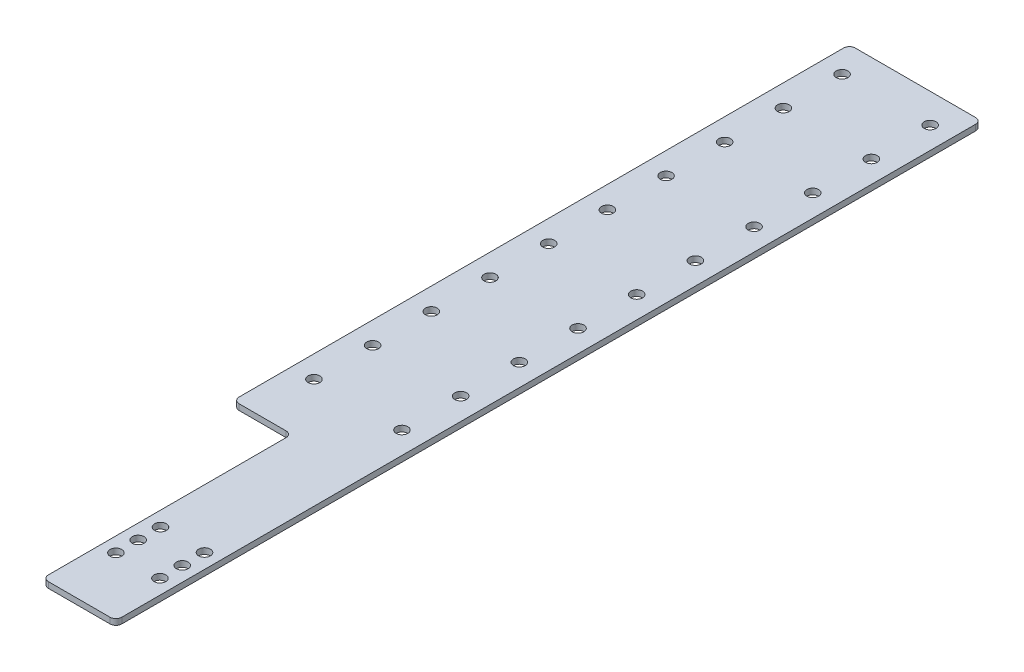
from build123d import *

# Parameters (mm, degrees)
BOSS_EXTRUDE1_DEPTH     = 1.27
CUT_EXTRUDE1_DEPTH      = 373.740805793
CUT_EXTRUDE1_DEPTH_BACK = 373.740805793
SKETCH2_R               = 2.54
CUT_EXTRUDE2_DEPTH      = 373.740805793
CUT_EXTRUDE2_DEPTH_BACK = 373.740805793
SKETCH3_R               = 2.54
FILLET2_R               = 2.54


with BuildPart() as part:
    # Sketch1 → Boss-Extrude1 (new, symmetric)
    with BuildSketch(Plane(origin=(0, 0, 0), x_dir=(1, 0, 0), z_dir=(0, 1, 0))):
        Polygon((-34.188416223, -6.711856618), (-2.438416223, -6.711856618), (-2.438416223, 367.938143382), (-59.588416223, 367.938143382), (-59.588416223, 101.238143382), (-34.188416223, 101.238143382), align=None)
    extrude(amount=BOSS_EXTRUDE1_DEPTH, both=True)

    # Sketch2 → Cut-Extrude1 (cut, two sides: drawn at the far end of the back side and taken through both)
    with BuildSketch(Plane(origin=(0, 1.27, 0), x_dir=(1, 0, 0), z_dir=(0, 1, 0)).offset(-CUT_EXTRUDE1_DEPTH_BACK)):
        with Locations(Location((-27.838416223, 18.688143382, 0), (0, 0, 270))):
            Circle(SKETCH2_R)
        with Locations(Location((-8.788416223, 18.688143382, 0), (0, 0, 270))):
            Circle(SKETCH2_R)
        with Locations(Location((-8.788416223, 28.340143382, 0), (0, 0, 270))):
            Circle(SKETCH2_R)
        with Locations(Location((-8.788416223, 37.992143382, 0), (0, 0, 270))):
            Circle(SKETCH2_R)
        with Locations(Location((-27.838416223, 28.340143382, 0), (0, 0, 270))):
            Circle(SKETCH2_R)
        with Locations(Location((-27.838416223, 37.992143382, 0), (0, 0, 270))):
            Circle(SKETCH2_R)
    extrude(amount=CUT_EXTRUDE1_DEPTH + CUT_EXTRUDE1_DEPTH_BACK, mode=Mode.SUBTRACT)

    # Sketch3 → Cut-Extrude2 (cut, two sides: drawn at the far end of the back side and taken through both)
    with BuildSketch(Plane(origin=(0, 1.27, 0), x_dir=(1, 0, 0), z_dir=(0, 1, 0)).offset(-CUT_EXTRUDE2_DEPTH_BACK)):
        with Locations(Location((-50.063416223, 126.638143382, 0), (0, 0, 270))):
            Circle(SKETCH3_R)
        with Locations(Location((-11.963416223, 126.638143382, 0), (0, 0, 270))):
            Circle(SKETCH3_R)
        with Locations(Location((-11.963416223, 152.038143382, 0), (0, 0, 270))):
            Circle(SKETCH3_R)
        with Locations(Location((-11.963416223, 177.438143382, 0), (0, 0, 270))):
            Circle(SKETCH3_R)
        with Locations(Location((-11.963416223, 202.838143382, 0), (0, 0, 270))):
            Circle(SKETCH3_R)
        with Locations(Location((-11.963416223, 228.238143382, 0), (0, 0, 270))):
            Circle(SKETCH3_R)
        with Locations(Location((-11.963416223, 253.638143382, 0), (0, 0, 270))):
            Circle(SKETCH3_R)
        with Locations(Location((-11.963416223, 279.038143382, 0), (0, 0, 270))):
            Circle(SKETCH3_R)
        with Locations(Location((-11.963416223, 304.438143382, 0), (0, 0, 270))):
            Circle(SKETCH3_R)
        with Locations(Location((-11.963416223, 329.838143382, 0), (0, 0, 270))):
            Circle(SKETCH3_R)
        with Locations(Location((-11.963416223, 355.238143382, 0), (0, 0, 270))):
            Circle(SKETCH3_R)
        with Locations(Location((-50.063416223, 152.038143382, 0), (0, 0, 270))):
            Circle(SKETCH3_R)
        with Locations(Location((-50.063416223, 177.438143382, 0), (0, 0, 270))):
            Circle(SKETCH3_R)
        with Locations(Location((-50.063416223, 202.838143382, 0), (0, 0, 270))):
            Circle(SKETCH3_R)
        with Locations(Location((-50.063416223, 228.238143382, 0), (0, 0, 270))):
            Circle(SKETCH3_R)
        with Locations(Location((-50.063416223, 253.638143382, 0), (0, 0, 270))):
            Circle(SKETCH3_R)
        with Locations(Location((-50.063416223, 279.038143382, 0), (0, 0, 270))):
            Circle(SKETCH3_R)
        with Locations(Location((-50.063416223, 304.438143382, 0), (0, 0, 270))):
            Circle(SKETCH3_R)
        with Locations(Location((-50.063416223, 329.838143382, 0), (0, 0, 270))):
            Circle(SKETCH3_R)
        with Locations(Location((-50.063416223, 355.238143382, 0), (0, 0, 270))):
            Circle(SKETCH3_R)
    extrude(amount=CUT_EXTRUDE2_DEPTH + CUT_EXTRUDE2_DEPTH_BACK, mode=Mode.SUBTRACT)

    # Fillet2
    fillet2_edges = [part.edges().sort_by_distance(p)[0] for p in [
        (-34.188416223, 0, -101.238143382),
        (-59.588416223, 0, -101.238143382),
        (-59.588416223, 0, -367.938143382),
        (-2.438416223, 0, -367.938143382),
        (-2.438416223, 0, 6.711856618),
        (-34.188416223, 0, 6.711856618),
    ]]
    fillet(fillet2_edges, radius=FILLET2_R)


solid = part.part
